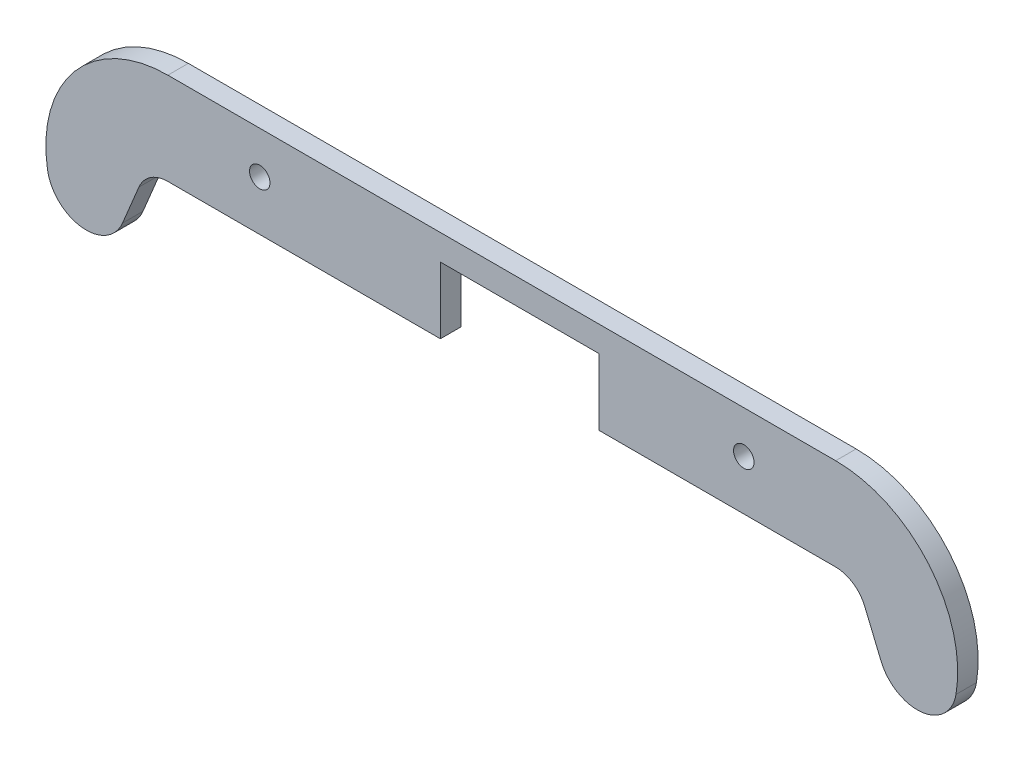
from build123d import *

# Parameters (mm, degrees)
BOSS_EXTRUDE1_DEPTH = 4
SKETCH3_R           = 2
CUT_EXTRUDE1_DEPTH  = 10
CUT_EXTRUDE2_DEPTH  = 167.695623666


with BuildPart() as part:
    # Sketch1 → Boss-Extrude1 (new body)
    with BuildSketch(Plane.XY):
        with BuildLine():
            Line((65.293896859, 140.79456376), (-65.293896859, 140.79456376))
            ThreePointArc((-65.293896859, 140.79456376), (-83.510437362, 132.343917874), (-88.822955159, 112.978151212))
            ThreePointArc((-88.822955159, 112.978151212), (-82.121571276, 106.62300147), (-74.161000128, 111.305498795))
            Line((-74.161000128, 111.305498795), (-70.965431907, 118.996456291))
            ThreePointArc((-70.965431907, 118.996456291), (-68.695430494, 121.757834263), (-65.274420897, 122.79456376))
            Line((-65.274420897, 122.79456376), (65.274420897, 122.79456376))
            ThreePointArc((65.274420897, 122.79456376), (68.695430494, 121.757834263), (70.965431907, 118.996456291))
            Line((70.965431907, 118.996456291), (74.161000128, 111.305498795))
            ThreePointArc((74.161000128, 111.305498795), (82.121571276, 106.62300147), (88.822955159, 112.978151212))
            ThreePointArc((88.822955159, 112.978151212), (83.510437362, 132.343917874), (65.293896859, 140.79456376))
        make_face()
    extrude(amount=BOSS_EXTRUDE1_DEPTH)

    # Sketch3 → Cut-Extrude1 (cut)
    with BuildSketch(Plane.XY.offset(4)):
        with Locations((-47.324700565, 132.53476761)):
            Circle(SKETCH3_R)
        with Locations((47.324700565, 132.53476761)):
            Circle(SKETCH3_R)
    extrude(amount=-CUT_EXTRUDE1_DEPTH, mode=Mode.SUBTRACT)

    # Sketch4 → Cut-Extrude2 (cut, through all)
    with BuildSketch(Plane.XY.offset(4)):
        Polygon((-11.999700565, 135.79456376), (-11.999700565, 126.79456376), (-11.999700565, 122.79456376), (19.000299435, 122.79456376), (19.000299435, 126.79456376), (19.000299435, 135.79456376), align=None)
    extrude(amount=-CUT_EXTRUDE2_DEPTH, mode=Mode.SUBTRACT)


solid = part.part
